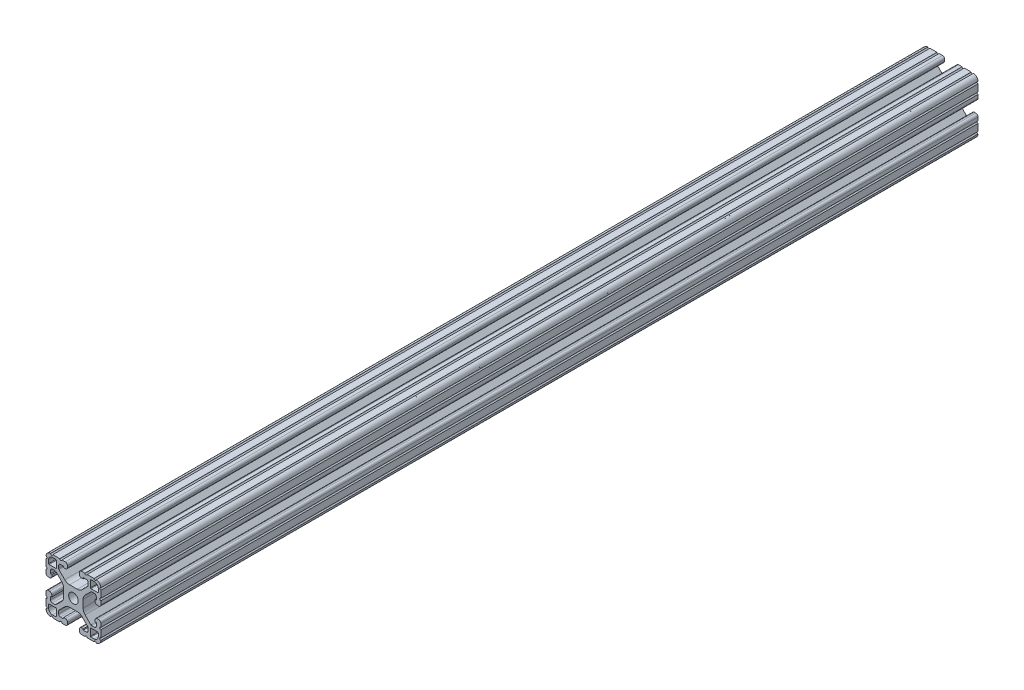
from build123d import *

# Parameters (mm, degrees)
SKETCH1_R      = 3.3274
EXTRUDE1_DEPTH = 609.6


with BuildPart() as part:
    # Sketch1 → Extrude1 (new body)
    with BuildSketch(Plane.XY):
        with BuildLine():
            Line((10.02670034, -12.151875049), (6.021451835, -8.147301292))
            ThreePointArc((6.021451835, -8.147301292), (4.48060392, -7.11788044), (2.663118988, -6.7564))
            Line((2.663118988, -6.7564), (-2.663118988, -6.7564))
            ThreePointArc((-2.663118988, -6.7564), (-4.48060392, -7.11788044), (-6.021451835, -8.147301292))
            Line((-6.021451835, -8.147301292), (-10.02670034, -12.151875049))
            ThreePointArc((-10.02670034, -12.151875049), (-10.219349756, -12.440155844), (-10.287, -12.78021916))
            Line((-10.287, -12.78021916), (-10.287, -14.55471092))
            ThreePointArc((-10.287, -14.55471092), (-9.915025612, -15.452736532), (-9.017, -15.82471092))
            Line((-9.017, -15.82471092), (-6.814144259, -15.82471092))
            Line((-6.814144259, -15.82471092), (-6.814144259, -14.986))
            Line((-6.814144259, -14.986), (-5.6388, -14.986))
            ThreePointArc((-5.6388, -14.986), (-4.525248241, -15.447248241), (-4.064, -16.5608))
            Line((-4.064, -16.5608), (-4.064, -17.4752))
            ThreePointArc((-4.064, -17.4752), (-4.525248241, -18.588751759), (-5.6388, -19.05))
            Line((-5.6388, -19.05), (-7.9756, -19.05))
            ThreePointArc((-7.9756, -19.05), (-8.7376, -18.288), (-9.4996, -19.05))
            Line((-9.4996, -19.05), (-14.3256, -19.05))
            ThreePointArc((-14.3256, -19.05), (-15.0876, -18.288), (-15.8496, -19.05))
            Line((-15.8496, -19.05), (-15.875, -19.05))
            ThreePointArc((-15.875, -19.05), (-18.12006403, -18.12006403), (-19.05, -15.875))
            Line((-19.05, -15.875), (-19.05, -15.8496))
            ThreePointArc((-19.05, -15.8496), (-18.288, -15.0876), (-19.05, -14.3256))
            Line((-19.05, -14.3256), (-19.05, -9.4996))
            ThreePointArc((-19.05, -9.4996), (-18.288, -8.7376), (-19.05, -7.9756))
            Line((-19.05, -7.9756), (-19.05, -5.6388))
            ThreePointArc((-19.05, -5.6388), (-18.588751759, -4.525248241), (-17.4752, -4.064))
            Line((-17.4752, -4.064), (-16.5608, -4.064))
            ThreePointArc((-16.5608, -4.064), (-15.447248241, -4.525248241), (-14.986, -5.6388))
            Line((-14.986, -5.6388), (-14.986, -6.750644259))
            Line((-14.986, -6.750644259), (-15.879033733, -6.750644259))
            Line((-15.879033733, -6.750644259), (-15.879033733, -8.919211783))
            ThreePointArc((-15.879033733, -8.919211783), (-15.507059345, -9.817237395), (-14.609033733, -10.189211783))
            Line((-14.609033733, -10.189211783), (-12.742784468, -10.189211783))
            ThreePointArc((-12.742784468, -10.189211783), (-12.402613491, -10.121555016), (-12.114219497, -9.928882664))
            Line((-12.114219497, -9.928882664), (-8.147867153, -5.963198517))
            ThreePointArc((-8.147867153, -5.963198517), (-7.118033561, -4.422154408), (-6.7564, -2.604299809))
            Line((-6.7564, -2.604299809), (-6.7564, 2.604299809))
            ThreePointArc((-6.7564, 2.604299809), (-7.118033561, 4.422154408), (-8.147867153, 5.963198517))
            Line((-8.147867153, 5.963198517), (-12.114219497, 9.928882664))
            ThreePointArc((-12.114219497, 9.928882664), (-12.402613491, 10.121555016), (-12.742784468, 10.189211783))
            Line((-12.742784468, 10.189211783), (-14.609033733, 10.189211783))
            ThreePointArc((-14.609033733, 10.189211783), (-15.507059345, 9.817237395), (-15.879033733, 8.919211783))
            Line((-15.879033733, 8.919211783), (-15.879033733, 6.750644259))
            Line((-15.879033733, 6.750644259), (-14.986, 6.750644259))
            Line((-14.986, 6.750644259), (-14.986, 5.6388))
            ThreePointArc((-14.986, 5.6388), (-15.447248241, 4.525248241), (-16.5608, 4.064))
            Line((-16.5608, 4.064), (-17.4752, 4.064))
            ThreePointArc((-17.4752, 4.064), (-18.588751759, 4.525248241), (-19.05, 5.6388))
            Line((-19.05, 5.6388), (-19.05, 7.9756))
            ThreePointArc((-19.05, 7.9756), (-18.288, 8.7376), (-19.05, 9.4996))
            Line((-19.05, 9.4996), (-19.05, 14.3256))
            ThreePointArc((-19.05, 14.3256), (-18.288, 15.0876), (-19.05, 15.8496))
            Line((-19.05, 15.8496), (-19.05, 15.875))
            ThreePointArc((-19.05, 15.875), (-18.12006403, 18.12006403), (-15.875, 19.05))
            Line((-15.875, 19.05), (-15.8496, 19.05))
            ThreePointArc((-15.8496, 19.05), (-15.0876, 18.288), (-14.3256, 19.05))
            Line((-14.3256, 19.05), (-9.4996, 19.05))
            ThreePointArc((-9.4996, 19.05), (-8.7376, 18.288), (-7.9756, 19.05))
            Line((-7.9756, 19.05), (-5.6388, 19.05))
            ThreePointArc((-5.6388, 19.05), (-4.525248241, 18.588751759), (-4.064, 17.4752))
            Line((-4.064, 17.4752), (-4.064, 16.5608))
            ThreePointArc((-4.064, 16.5608), (-4.525248241, 15.447248241), (-5.6388, 14.986))
            Line((-5.6388, 14.986), (-6.814144259, 14.986))
            Line((-6.814144259, 14.986), (-6.814144259, 15.82471092))
            Line((-6.814144259, 15.82471092), (-9.017, 15.82471092))
            ThreePointArc((-9.017, 15.82471092), (-9.915025612, 15.452736532), (-10.287, 14.55471092))
            Line((-10.287, 14.55471092), (-10.287, 12.78021916))
            ThreePointArc((-10.287, 12.78021916), (-10.219349756, 12.440155844), (-10.02670034, 12.151875049))
            Line((-10.02670034, 12.151875049), (-6.021451835, 8.147301292))
            ThreePointArc((-6.021451835, 8.147301292), (-4.48060392, 7.11788044), (-2.663118988, 6.7564))
            Line((-2.663118988, 6.7564), (2.663118988, 6.7564))
            ThreePointArc((2.663118988, 6.7564), (4.48060392, 7.11788044), (6.021451835, 8.147301292))
            Line((6.021451835, 8.147301292), (10.02670034, 12.151875049))
            ThreePointArc((10.02670034, 12.151875049), (10.219349756, 12.440155844), (10.287, 12.78021916))
            Line((10.287, 12.78021916), (10.287, 14.55471092))
            ThreePointArc((10.287, 14.55471092), (9.915025612, 15.452736532), (9.017, 15.82471092))
            Line((9.017, 15.82471092), (6.814144259, 15.82471092))
            Line((6.814144259, 15.82471092), (6.814144259, 14.986))
            Line((6.814144259, 14.986), (5.6388, 14.986))
            ThreePointArc((5.6388, 14.986), (4.525248241, 15.447248241), (4.064, 16.5608))
            Line((4.064, 16.5608), (4.064, 17.4752))
            ThreePointArc((4.064, 17.4752), (4.525248241, 18.588751759), (5.6388, 19.05))
            Line((5.6388, 19.05), (7.9756, 19.05))
            ThreePointArc((7.9756, 19.05), (8.7376, 18.288), (9.4996, 19.05))
            Line((9.4996, 19.05), (14.3256, 19.05))
            ThreePointArc((14.3256, 19.05), (15.0876, 18.288), (15.8496, 19.05))
            Line((15.8496, 19.05), (15.875, 19.05))
            ThreePointArc((15.875, 19.05), (18.12006403, 18.12006403), (19.05, 15.875))
            Line((19.05, 15.875), (19.05, 15.8496))
            ThreePointArc((19.05, 15.8496), (18.288, 15.0876), (19.05, 14.3256))
            Line((19.05, 14.3256), (19.05, 9.4996))
            ThreePointArc((19.05, 9.4996), (18.288, 8.7376), (19.05, 7.9756))
            Line((19.05, 7.9756), (19.05, 5.6388))
            ThreePointArc((19.05, 5.6388), (18.588751759, 4.525248241), (17.4752, 4.064))
            Line((17.4752, 4.064), (16.5608, 4.064))
            ThreePointArc((16.5608, 4.064), (15.447248241, 4.525248241), (14.986, 5.6388))
            Line((14.986, 5.6388), (14.986, 6.750644259))
            Line((14.986, 6.750644259), (15.879033733, 6.750644259))
            Line((15.879033733, 6.750644259), (15.879033733, 8.919211783))
            ThreePointArc((15.879033733, 8.919211783), (15.507059345, 9.817237395), (14.609033733, 10.189211783))
            Line((14.609033733, 10.189211783), (12.742784468, 10.189211783))
            ThreePointArc((12.742784468, 10.189211783), (12.402613491, 10.121555016), (12.114219497, 9.928882664))
            Line((12.114219497, 9.928882664), (8.147867153, 5.963198517))
            ThreePointArc((8.147867153, 5.963198517), (7.118033561, 4.422154408), (6.7564, 2.604299809))
            Line((6.7564, 2.604299809), (6.7564, -2.604299809))
            ThreePointArc((6.7564, -2.604299809), (7.118033561, -4.422154408), (8.147867153, -5.963198517))
            Line((8.147867153, -5.963198517), (12.114219497, -9.928882664))
            ThreePointArc((12.114219497, -9.928882664), (12.402613491, -10.121555016), (12.742784468, -10.189211783))
            Line((12.742784468, -10.189211783), (14.609033733, -10.189211783))
            ThreePointArc((14.609033733, -10.189211783), (15.507059345, -9.817237395), (15.879033733, -8.919211783))
            Line((15.879033733, -8.919211783), (15.879033733, -6.750644259))
            Line((15.879033733, -6.750644259), (14.986, -6.750644259))
            Line((14.986, -6.750644259), (14.986, -5.6388))
            ThreePointArc((14.986, -5.6388), (15.447248241, -4.525248241), (16.5608, -4.064))
            Line((16.5608, -4.064), (17.4752, -4.064))
            ThreePointArc((17.4752, -4.064), (18.588751759, -4.525248241), (19.05, -5.6388))
            Line((19.05, -5.6388), (19.05, -7.9756))
            ThreePointArc((19.05, -7.9756), (18.288, -8.7376), (19.05, -9.4996))
            Line((19.05, -9.4996), (19.05, -14.3256))
            ThreePointArc((19.05, -14.3256), (18.288, -15.0876), (19.05, -15.8496))
            Line((19.05, -15.8496), (19.05, -15.875))
            ThreePointArc((19.05, -15.875), (18.12006403, -18.12006403), (15.875, -19.05))
            Line((15.875, -19.05), (15.8496, -19.05))
            ThreePointArc((15.8496, -19.05), (15.0876, -18.288), (14.3256, -19.05))
            Line((14.3256, -19.05), (9.4996, -19.05))
            ThreePointArc((9.4996, -19.05), (8.7376, -18.288), (7.9756, -19.05))
            Line((7.9756, -19.05), (5.6388, -19.05))
            ThreePointArc((5.6388, -19.05), (4.525248241, -18.588751759), (4.064, -17.4752))
            Line((4.064, -17.4752), (4.064, -16.5608))
            ThreePointArc((4.064, -16.5608), (4.525248241, -15.447248241), (5.6388, -14.986))
            Line((5.6388, -14.986), (6.814144259, -14.986))
            Line((6.814144259, -14.986), (6.814144259, -15.82471092))
            Line((6.814144259, -15.82471092), (9.017, -15.82471092))
            ThreePointArc((9.017, -15.82471092), (9.915025612, -15.452736532), (10.287, -14.55471092))
            Line((10.287, -14.55471092), (10.287, -12.78021916))
            ThreePointArc((10.287, -12.78021916), (10.219349756, -12.440155844), (10.02670034, -12.151875049))
        make_face()
        Circle(SKETCH1_R, mode=Mode.SUBTRACT)
        with BuildLine():
            Line((16.891, -11.8618), (12.2428, -11.8618))
            ThreePointArc((12.2428, -11.8618), (11.973392316, -11.973392316), (11.8618, -12.2428))
            Line((11.8618, -12.2428), (11.8618, -16.891))
            ThreePointArc((11.8618, -16.891), (11.973392316, -17.160407684), (12.2428, -17.272))
            Line((12.2428, -17.272), (14.478, -17.272))
            ThreePointArc((14.478, -17.272), (16.453656347, -16.453656347), (17.272, -14.478))
            Line((17.272, -14.478), (17.272, -12.2428))
            ThreePointArc((17.272, -12.2428), (17.160407684, -11.973392316), (16.891, -11.8618))
        make_face(mode=Mode.SUBTRACT)
        with BuildLine():
            Line((17.272, 14.478), (17.272, 12.2428))
            ThreePointArc((17.272, 12.2428), (17.160407684, 11.973392316), (16.891, 11.8618))
            Line((16.891, 11.8618), (12.2428, 11.8618))
            ThreePointArc((12.2428, 11.8618), (11.973392316, 11.973392316), (11.8618, 12.2428))
            Line((11.8618, 12.2428), (11.8618, 16.891))
            ThreePointArc((11.8618, 16.891), (11.973392316, 17.160407684), (12.2428, 17.272))
            Line((12.2428, 17.272), (14.478, 17.272))
            ThreePointArc((14.478, 17.272), (16.453656347, 16.453656347), (17.272, 14.478))
        make_face(mode=Mode.SUBTRACT)
        with BuildLine():
            Line((-17.272, -14.478), (-17.272, -12.2428))
            ThreePointArc((-17.272, -12.2428), (-17.160407684, -11.973392316), (-16.891, -11.8618))
            Line((-16.891, -11.8618), (-12.2428, -11.8618))
            ThreePointArc((-12.2428, -11.8618), (-11.973392316, -11.973392316), (-11.8618, -12.2428))
            Line((-11.8618, -12.2428), (-11.8618, -16.891))
            ThreePointArc((-11.8618, -16.891), (-11.973392316, -17.160407684), (-12.2428, -17.272))
            Line((-12.2428, -17.272), (-14.478, -17.272))
            ThreePointArc((-14.478, -17.272), (-16.453656347, -16.453656347), (-17.272, -14.478))
        make_face(mode=Mode.SUBTRACT)
        with BuildLine():
            Line((-16.891, 11.8618), (-12.2428, 11.8618))
            ThreePointArc((-12.2428, 11.8618), (-11.973392316, 11.973392316), (-11.8618, 12.2428))
            Line((-11.8618, 12.2428), (-11.8618, 16.891))
            ThreePointArc((-11.8618, 16.891), (-11.973392316, 17.160407684), (-12.2428, 17.272))
            Line((-12.2428, 17.272), (-14.478, 17.272))
            ThreePointArc((-14.478, 17.272), (-16.453656347, 16.453656347), (-17.272, 14.478))
            Line((-17.272, 14.478), (-17.272, 12.2428))
            ThreePointArc((-17.272, 12.2428), (-17.160407684, 11.973392316), (-16.891, 11.8618))
        make_face(mode=Mode.SUBTRACT)
    extrude(amount=-EXTRUDE1_DEPTH)


solid = part.part
